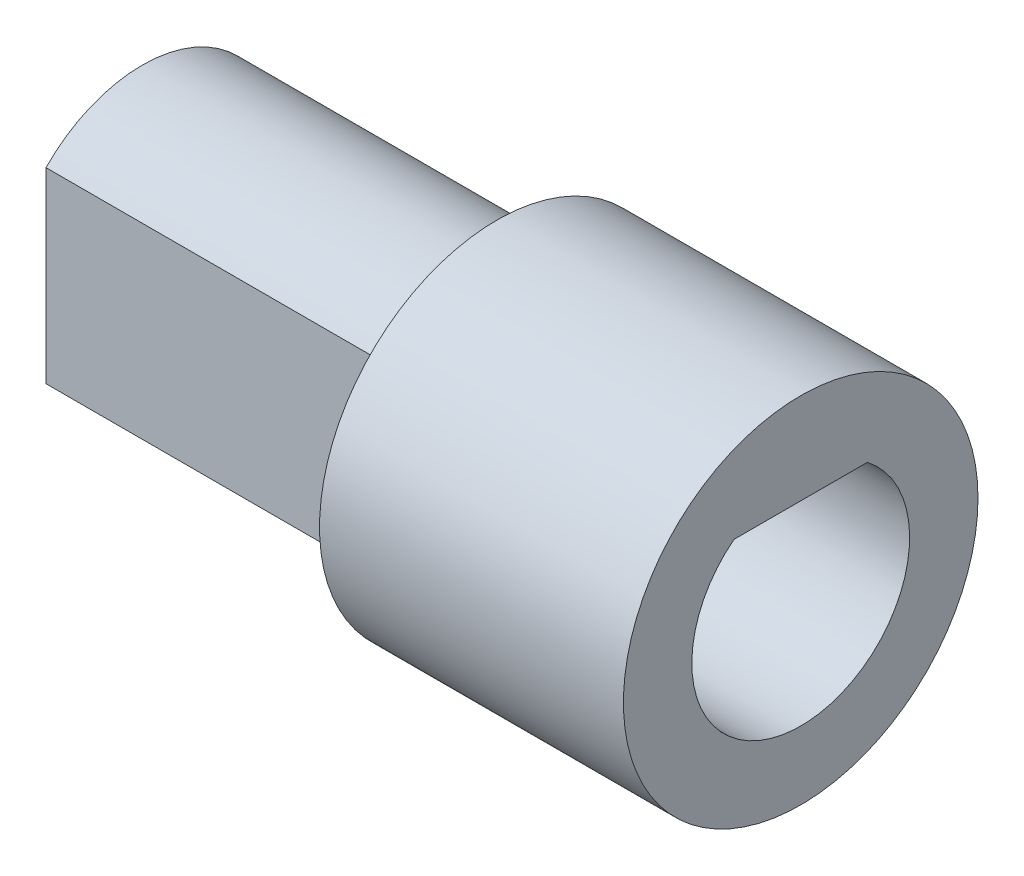
from build123d import *

# Parameters (mm, degrees)
BOSS_EXTRUDE1_DEPTH = 7
SKETCH5_R           = 3.5
BOSS_EXTRUDE2_DEPTH = 6
FILLET1_R           = 0.5
CUT_EXTRUDE1_DEPTH  = 5


with BuildPart() as part:
    # Sketch1 → Boss-Extrude1 (new body)
    with BuildSketch(Plane(origin=(0, 0, 0), x_dir=(0, 0, -1), z_dir=(1, 0, 0))):
        with BuildLine():
            Line((-1.9, 1.84729532), (-1.9, -1.84729532))
            ThreePointArc((-1.9, -1.84729532), (0, -2.65), (1.9, -1.84729532))
            Line((1.9, -1.84729532), (1.9, 1.84729532))
            ThreePointArc((1.9, 1.84729532), (0, 2.65), (-1.9, 1.84729532))
        make_face()
    extrude(amount=-BOSS_EXTRUDE1_DEPTH)

    # Sketch5 → Boss-Extrude2 (add)
    with BuildSketch(Plane(origin=(0, 0, 0), x_dir=(0, 0, -1), z_dir=(1, 0, 0))):
        Circle(SKETCH5_R)
    extrude(amount=BOSS_EXTRUDE2_DEPTH)

    # Fillet1
    fillet1_edges = [part.edges().sort_by_distance(p)[0] for p in [
        (0, 0, -1.9),
        (0, -2.65, 0),
        (0, 0, 1.9),
        (0, 2.65, 0),
    ]]
    fillet(fillet1_edges, radius=FILLET1_R)

    # Sketch7 → Cut-Extrude1 (cut)
    with BuildSketch(Plane(origin=(6, 0, 0), x_dir=(0, 0, -1), z_dir=(1, 0, 0))):
        with BuildLine():
            Line((-1.316244658, 1.7), (1.316244658, 1.7))
            ThreePointArc((1.316244658, 1.7), (0, -2.15), (-1.316244658, 1.7))
        make_face()
    extrude(amount=-CUT_EXTRUDE1_DEPTH, mode=Mode.SUBTRACT)


solid = part.part
